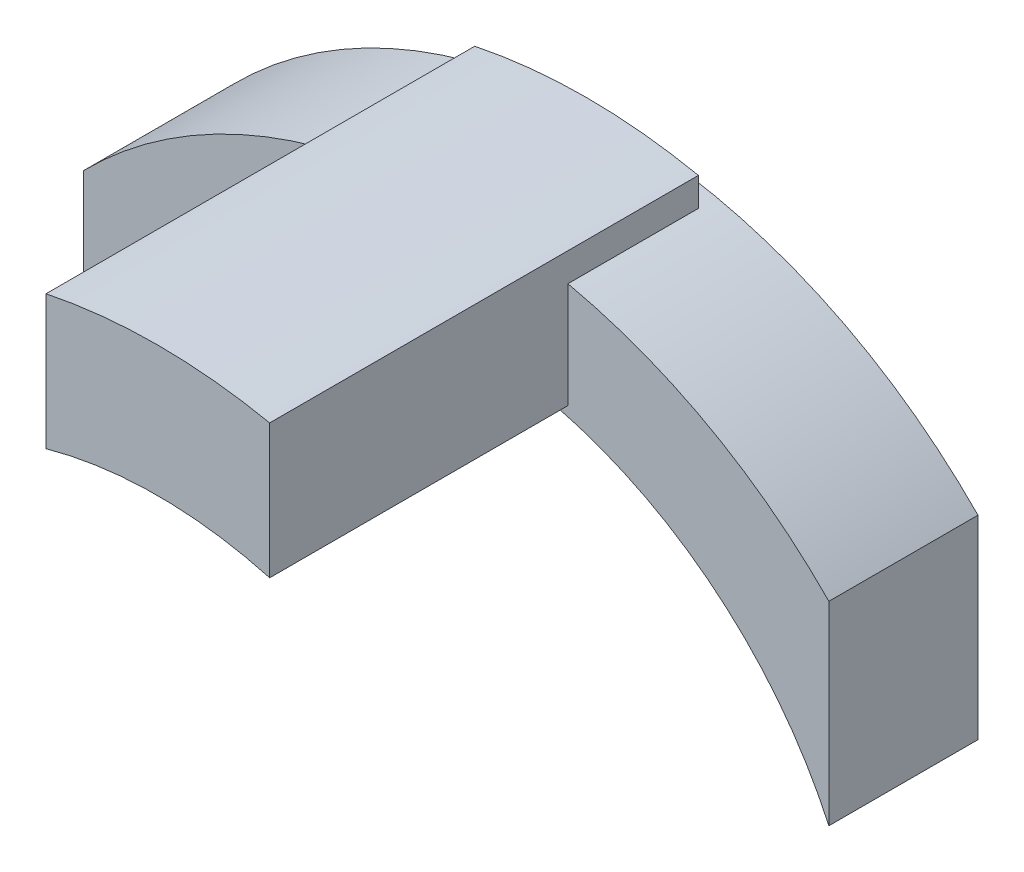
from build123d import *

# Parameters (mm, degrees)
EXTRUDE1_DEPTH      = 4
EXTRUDE2_DEPTH      = 7
EXTRUDE2_DEPTH_BACK = 16


with BuildPart() as part:
    # Sketch1 → Extrude1 (new, symmetric)
    with BuildSketch(Plane.XY):
        with BuildLine():
            Line((-20, 9.16515139), (-20, 19.595917942))
            ThreePointArc((-20, 19.595917942), (0, 28), (20, 19.595917942))
            Line((20, 19.595917942), (20, 9.16515139))
            ThreePointArc((20, 9.16515139), (0, 22), (-20, 9.16515139))
        make_face()
    extrude(amount=EXTRUDE1_DEPTH, both=True)

    # Sketch2 → Extrude2 (add, two sides: drawn at the far end of the back side and taken through both)
    with BuildSketch(Plane(origin=(0, 0, 4), x_dir=(-1, 0, 0), z_dir=(0, 0, -1)).offset(-EXTRUDE2_DEPTH_BACK)):
        with BuildLine():
            Line((6, 21.685248442), (6, 28.883386228))
            ThreePointArc((6, 28.883386228), (0, 29.5), (-6, 28.883386228))
            Line((-6, 28.883386228), (-6, 21.685248442))
            ThreePointArc((-6, 21.685248442), (0, 22.5), (6, 21.685248442))
        make_face()
    extrude(amount=EXTRUDE2_DEPTH + EXTRUDE2_DEPTH_BACK)


solid = part.part
